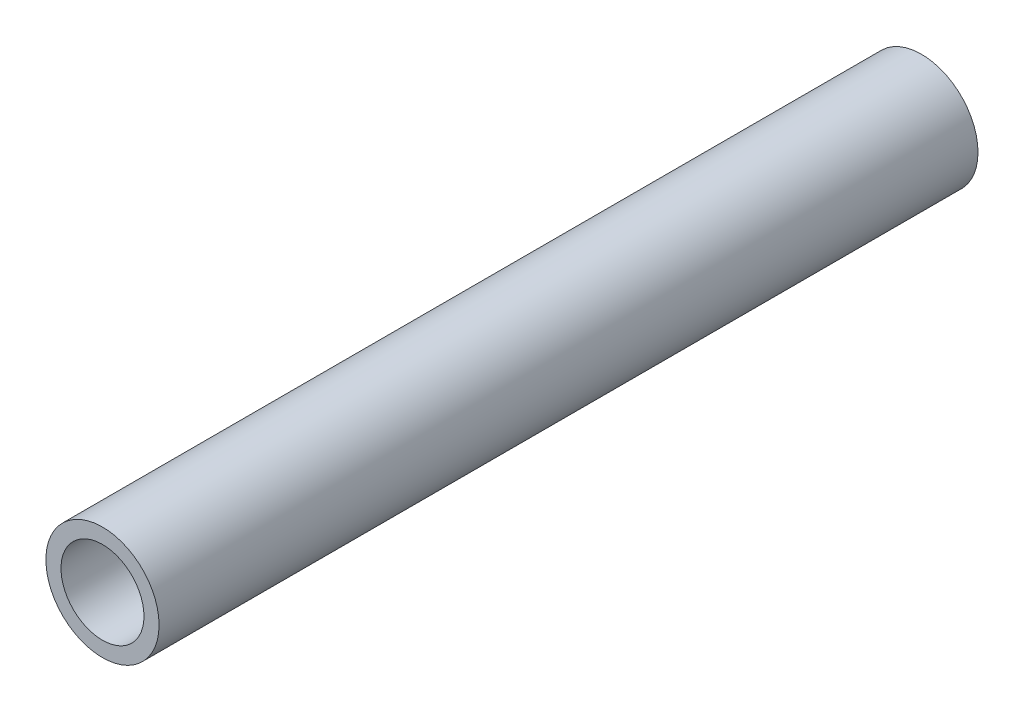
from build123d import *

# Parameters (mm, degrees)
SKETCH2_R           = 36.856385822
SKETCH2_R_2         = 27.027212773
BOSS_EXTRUDE1_DEPTH = 533.4


with BuildPart() as part:
    # Sketch2 → Boss-Extrude1 (new body)
    with BuildSketch(Plane.XY):
        Circle(SKETCH2_R)
        Circle(SKETCH2_R_2, mode=Mode.SUBTRACT)
    extrude(amount=BOSS_EXTRUDE1_DEPTH)


solid = part.part
